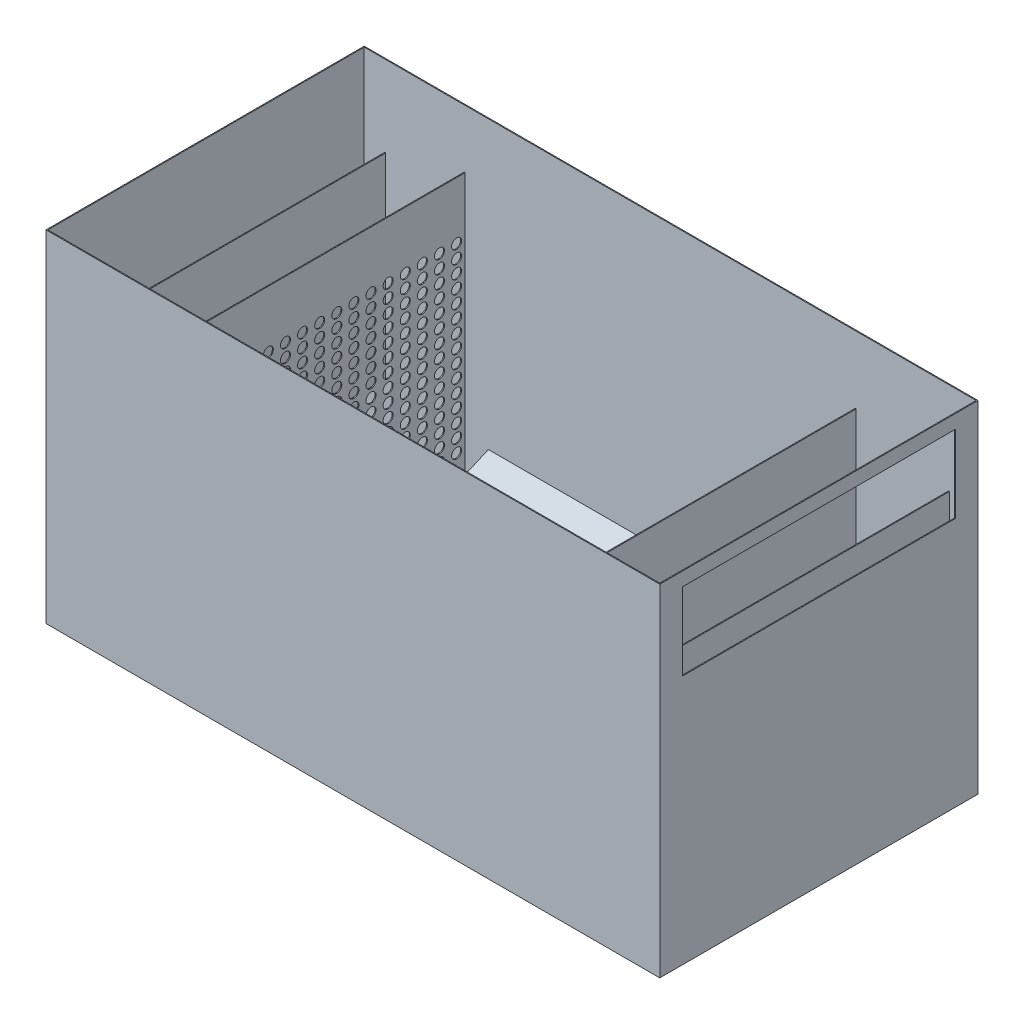
from build123d import *

# Parameters (mm, degrees)
MASTER_FOOTPRINT_W            = 1350
MASTER_FOOTPRINT_H            = 700
BATH_BASE_PLATE_DEPTH         = 750
BATH_SHELL_2MM_T              = -2
SKETCH_1_R                    = 50
INLET_D100_OPENING_DEPTH      = 10
INLET_IMPACT_BAFFLE_START     = 125
SKETCH_2_W                    = 540
SKETCH_2_H                    = 430
INLET_IMPACT_BAFFLE_DEPTH     = 2
DISTRIBUTOR_D22_START         = 250
SKETCH_3_W                    = 640
SKETCH_3_H                    = 648
SKETCH_3_R                    = 11
DISTRIBUTOR_D22_DEPTH         = 2
OUTLET_SUBMERGED_BAFFLE_START = 1130
SKETCH_4_W                    = 600
SKETCH_4_H                    = 330
OUTLET_SUBMERGED_BAFFLE_DEPTH = 2
OVERFLOW_WEIR_Z550_START      = 1290
SKETCH_5_W                    = 690
SKETCH_5_H                    = 548
OVERFLOW_WEIR_Z550_DEPTH      = 2
OUTLET_WEIR_SLOT_W600_START   = 1345
SKETCH_6_W                    = 600
SKETCH_6_H                    = 170
OUTLET_WEIR_SLOT_W600_DEPTH   = 10
SLOPED_SEDIMENT_FLOOR_START   = 275
SLOPED_SEDIMENT_FLOOR_DEPTH   = 825


with BuildPart() as part:
    # MASTER_FOOTPRINT → BATH_BASE_PLATE (new body)
    with BuildSketch(Plane(origin=(0, 0, 0), x_dir=(1, 0, 0), z_dir=(0, 1, 0))):
        with Locations((675, 350)):
            Rectangle(MASTER_FOOTPRINT_W, MASTER_FOOTPRINT_H)
    extrude(amount=BATH_BASE_PLATE_DEPTH)

    # BATH_SHELL_2MM
    bath_shell_2mm_openings = [part.faces().sort_by_distance(p)[0] for p in [
        (675, 750, -350),
    ]]
    offset(amount=BATH_SHELL_2MM_T, openings=bath_shell_2mm_openings, kind=Kind.INTERSECTION)

    # Эскиз1 → INLET_D100_OPENING (cut)
    with BuildSketch(Plane(origin=(0, 0, 0), x_dir=(0, 0, -1), z_dir=(1, 0, 0))):
        with Locations((350, 420)):
            Circle(SKETCH_1_R)
    extrude(amount=INLET_D100_OPENING_DEPTH, mode=Mode.SUBTRACT)

    # Эскиз6 → OUTLET_WEIR_SLOT_W600 (cut)
    with BuildSketch(Plane(origin=(0, 0, 0), x_dir=(0, 0, -1), z_dir=(1, 0, 0)).offset(OUTLET_WEIR_SLOT_W600_START)):
        with Locations((350, 635)):
            Rectangle(SKETCH_6_W, SKETCH_6_H)
    extrude(amount=OUTLET_WEIR_SLOT_W600_DEPTH, mode=Mode.SUBTRACT)

    # Эскиз7 → SLOPED_SEDIMENT_FLOOR (add)
    with BuildSketch(Plane(origin=(0, 0, 0), x_dir=(0, 0, -1), z_dir=(1, 0, 0)).offset(SLOPED_SEDIMENT_FLOOR_START)):
        Polygon((2, -1), (2, 120), (280, -1), align=None)
        Polygon((698, -1), (698, 120), (420, -1), align=None)
    extrude(amount=SLOPED_SEDIMENT_FLOOR_DEPTH)


with BuildPart() as body_2:
    # Эскиз2 → INLET_IMPACT_BAFFLE (new body)
    with BuildSketch(Plane(origin=(0, 0, 0), x_dir=(0, 0, -1), z_dir=(1, 0, 0)).offset(INLET_IMPACT_BAFFLE_START)):
        with Locations((350, 435)):
            Rectangle(SKETCH_2_W, SKETCH_2_H)
    extrude(amount=INLET_IMPACT_BAFFLE_DEPTH)


with BuildPart() as body_3:
    # Эскиз3 → DISTRIBUTOR_D22 (new body)
    with BuildSketch(Plane(origin=(0, 0, 0), x_dir=(0, 0, -1), z_dir=(1, 0, 0)).offset(DISTRIBUTOR_D22_START)):
        with Locations((350, 326)):
            Rectangle(SKETCH_3_W, SKETCH_3_H)
        with Locations((48.823529412, 125)):
            Circle(SKETCH_3_R, mode=Mode.SUBTRACT)
        with Locations((48.823529412, 153.5)):
            Circle(SKETCH_3_R, mode=Mode.SUBTRACT)
        with Locations((48.823529412, 182)):
            Circle(SKETCH_3_R, mode=Mode.SUBTRACT)
        with Locations((48.823529412, 210.5)):
            Circle(SKETCH_3_R, mode=Mode.SUBTRACT)
        with Locations((48.823529412, 239)):
            Circle(SKETCH_3_R, mode=Mode.SUBTRACT)
        with Locations((48.823529412, 267.5)):
            Circle(SKETCH_3_R, mode=Mode.SUBTRACT)
        with Locations((48.823529412, 296)):
            Circle(SKETCH_3_R, mode=Mode.SUBTRACT)
        with Locations((48.823529412, 324.5)):
            Circle(SKETCH_3_R, mode=Mode.SUBTRACT)
        with Locations((48.823529412, 353)):
            Circle(SKETCH_3_R, mode=Mode.SUBTRACT)
        with Locations((48.823529412, 381.5)):
            Circle(SKETCH_3_R, mode=Mode.SUBTRACT)
        with Locations((48.823529412, 410)):
            Circle(SKETCH_3_R, mode=Mode.SUBTRACT)
        with Locations((48.823529412, 438.5)):
            Circle(SKETCH_3_R, mode=Mode.SUBTRACT)
        with Locations((48.823529412, 467)):
            Circle(SKETCH_3_R, mode=Mode.SUBTRACT)
        with Locations((48.823529412, 495.5)):
            Circle(SKETCH_3_R, mode=Mode.SUBTRACT)
        with Locations((48.823529412, 524)):
            Circle(SKETCH_3_R, mode=Mode.SUBTRACT)
        with Locations((86.470588235, 125)):
            Circle(SKETCH_3_R, mode=Mode.SUBTRACT)
        with Locations((86.470588235, 153.5)):
            Circle(SKETCH_3_R, mode=Mode.SUBTRACT)
        with Locations((86.470588235, 182)):
            Circle(SKETCH_3_R, mode=Mode.SUBTRACT)
        with Locations((86.470588235, 210.5)):
            Circle(SKETCH_3_R, mode=Mode.SUBTRACT)
        with Locations((86.470588235, 239)):
            Circle(SKETCH_3_R, mode=Mode.SUBTRACT)
        with Locations((86.470588235, 267.5)):
            Circle(SKETCH_3_R, mode=Mode.SUBTRACT)
        with Locations((86.470588235, 296)):
            Circle(SKETCH_3_R, mode=Mode.SUBTRACT)
        with Locations((86.470588235, 324.5)):
            Circle(SKETCH_3_R, mode=Mode.SUBTRACT)
        with Locations((86.470588235, 353)):
            Circle(SKETCH_3_R, mode=Mode.SUBTRACT)
        with Locations((86.470588235, 381.5)):
            Circle(SKETCH_3_R, mode=Mode.SUBTRACT)
        with Locations((86.470588235, 410)):
            Circle(SKETCH_3_R, mode=Mode.SUBTRACT)
        with Locations((86.470588235, 438.5)):
            Circle(SKETCH_3_R, mode=Mode.SUBTRACT)
        with Locations((86.470588235, 467)):
            Circle(SKETCH_3_R, mode=Mode.SUBTRACT)
        with Locations((86.470588235, 495.5)):
            Circle(SKETCH_3_R, mode=Mode.SUBTRACT)
        with Locations((86.470588235, 524)):
            Circle(SKETCH_3_R, mode=Mode.SUBTRACT)
        with Locations((124.117647059, 125)):
            Circle(SKETCH_3_R, mode=Mode.SUBTRACT)
        with Locations((124.117647059, 153.5)):
            Circle(SKETCH_3_R, mode=Mode.SUBTRACT)
        with Locations((124.117647059, 182)):
            Circle(SKETCH_3_R, mode=Mode.SUBTRACT)
        with Locations((124.117647059, 210.5)):
            Circle(SKETCH_3_R, mode=Mode.SUBTRACT)
        with Locations((124.117647059, 239)):
            Circle(SKETCH_3_R, mode=Mode.SUBTRACT)
        with Locations((124.117647059, 267.5)):
            Circle(SKETCH_3_R, mode=Mode.SUBTRACT)
        with Locations((124.117647059, 296)):
            Circle(SKETCH_3_R, mode=Mode.SUBTRACT)
        with Locations((124.117647059, 324.5)):
            Circle(SKETCH_3_R, mode=Mode.SUBTRACT)
        with Locations((124.117647059, 353)):
            Circle(SKETCH_3_R, mode=Mode.SUBTRACT)
        with Locations((124.117647059, 381.5)):
            Circle(SKETCH_3_R, mode=Mode.SUBTRACT)
        with Locations((124.117647059, 410)):
            Circle(SKETCH_3_R, mode=Mode.SUBTRACT)
        with Locations((124.117647059, 438.5)):
            Circle(SKETCH_3_R, mode=Mode.SUBTRACT)
        with Locations((124.117647059, 467)):
            Circle(SKETCH_3_R, mode=Mode.SUBTRACT)
        with Locations((124.117647059, 495.5)):
            Circle(SKETCH_3_R, mode=Mode.SUBTRACT)
        with Locations((124.117647059, 524)):
            Circle(SKETCH_3_R, mode=Mode.SUBTRACT)
        with Locations((161.764705882, 125)):
            Circle(SKETCH_3_R, mode=Mode.SUBTRACT)
        with Locations((161.764705882, 153.5)):
            Circle(SKETCH_3_R, mode=Mode.SUBTRACT)
        with Locations((161.764705882, 182)):
            Circle(SKETCH_3_R, mode=Mode.SUBTRACT)
        with Locations((161.764705882, 210.5)):
            Circle(SKETCH_3_R, mode=Mode.SUBTRACT)
        with Locations((161.764705882, 239)):
            Circle(SKETCH_3_R, mode=Mode.SUBTRACT)
        with Locations((161.764705882, 267.5)):
            Circle(SKETCH_3_R, mode=Mode.SUBTRACT)
        with Locations((161.764705882, 296)):
            Circle(SKETCH_3_R, mode=Mode.SUBTRACT)
        with Locations((161.764705882, 324.5)):
            Circle(SKETCH_3_R, mode=Mode.SUBTRACT)
        with Locations((161.764705882, 353)):
            Circle(SKETCH_3_R, mode=Mode.SUBTRACT)
        with Locations((161.764705882, 381.5)):
            Circle(SKETCH_3_R, mode=Mode.SUBTRACT)
        with Locations((161.764705882, 410)):
            Circle(SKETCH_3_R, mode=Mode.SUBTRACT)
        with Locations((161.764705882, 438.5)):
            Circle(SKETCH_3_R, mode=Mode.SUBTRACT)
        with Locations((161.764705882, 467)):
            Circle(SKETCH_3_R, mode=Mode.SUBTRACT)
        with Locations((161.764705882, 495.5)):
            Circle(SKETCH_3_R, mode=Mode.SUBTRACT)
        with Locations((161.764705882, 524)):
            Circle(SKETCH_3_R, mode=Mode.SUBTRACT)
        with Locations((199.411764706, 125)):
            Circle(SKETCH_3_R, mode=Mode.SUBTRACT)
        with Locations((199.411764706, 153.5)):
            Circle(SKETCH_3_R, mode=Mode.SUBTRACT)
        with Locations((199.411764706, 182)):
            Circle(SKETCH_3_R, mode=Mode.SUBTRACT)
        with Locations((199.411764706, 210.5)):
            Circle(SKETCH_3_R, mode=Mode.SUBTRACT)
        with Locations((199.411764706, 239)):
            Circle(SKETCH_3_R, mode=Mode.SUBTRACT)
        with Locations((199.411764706, 267.5)):
            Circle(SKETCH_3_R, mode=Mode.SUBTRACT)
        with Locations((199.411764706, 296)):
            Circle(SKETCH_3_R, mode=Mode.SUBTRACT)
        with Locations((199.411764706, 324.5)):
            Circle(SKETCH_3_R, mode=Mode.SUBTRACT)
        with Locations((199.411764706, 353)):
            Circle(SKETCH_3_R, mode=Mode.SUBTRACT)
        with Locations((199.411764706, 381.5)):
            Circle(SKETCH_3_R, mode=Mode.SUBTRACT)
        with Locations((199.411764706, 410)):
            Circle(SKETCH_3_R, mode=Mode.SUBTRACT)
        with Locations((199.411764706, 438.5)):
            Circle(SKETCH_3_R, mode=Mode.SUBTRACT)
        with Locations((199.411764706, 467)):
            Circle(SKETCH_3_R, mode=Mode.SUBTRACT)
        with Locations((199.411764706, 495.5)):
            Circle(SKETCH_3_R, mode=Mode.SUBTRACT)
        with Locations((199.411764706, 524)):
            Circle(SKETCH_3_R, mode=Mode.SUBTRACT)
        with Locations((237.058823529, 125)):
            Circle(SKETCH_3_R, mode=Mode.SUBTRACT)
        with Locations((237.058823529, 153.5)):
            Circle(SKETCH_3_R, mode=Mode.SUBTRACT)
        with Locations((237.058823529, 182)):
            Circle(SKETCH_3_R, mode=Mode.SUBTRACT)
        with Locations((237.058823529, 210.5)):
            Circle(SKETCH_3_R, mode=Mode.SUBTRACT)
        with Locations((237.058823529, 239)):
            Circle(SKETCH_3_R, mode=Mode.SUBTRACT)
        with Locations((237.058823529, 267.5)):
            Circle(SKETCH_3_R, mode=Mode.SUBTRACT)
        with Locations((237.058823529, 296)):
            Circle(SKETCH_3_R, mode=Mode.SUBTRACT)
        with Locations((237.058823529, 324.5)):
            Circle(SKETCH_3_R, mode=Mode.SUBTRACT)
        with Locations((237.058823529, 353)):
            Circle(SKETCH_3_R, mode=Mode.SUBTRACT)
        with Locations((237.058823529, 381.5)):
            Circle(SKETCH_3_R, mode=Mode.SUBTRACT)
        with Locations((237.058823529, 410)):
            Circle(SKETCH_3_R, mode=Mode.SUBTRACT)
        with Locations((237.058823529, 438.5)):
            Circle(SKETCH_3_R, mode=Mode.SUBTRACT)
        with Locations((237.058823529, 467)):
            Circle(SKETCH_3_R, mode=Mode.SUBTRACT)
        with Locations((237.058823529, 495.5)):
            Circle(SKETCH_3_R, mode=Mode.SUBTRACT)
        with Locations((237.058823529, 524)):
            Circle(SKETCH_3_R, mode=Mode.SUBTRACT)
        with Locations((274.705882353, 125)):
            Circle(SKETCH_3_R, mode=Mode.SUBTRACT)
        with Locations((274.705882353, 153.5)):
            Circle(SKETCH_3_R, mode=Mode.SUBTRACT)
        with Locations((274.705882353, 182)):
            Circle(SKETCH_3_R, mode=Mode.SUBTRACT)
        with Locations((274.705882353, 210.5)):
            Circle(SKETCH_3_R, mode=Mode.SUBTRACT)
        with Locations((274.705882353, 239)):
            Circle(SKETCH_3_R, mode=Mode.SUBTRACT)
        with Locations((274.705882353, 267.5)):
            Circle(SKETCH_3_R, mode=Mode.SUBTRACT)
        with Locations((274.705882353, 296)):
            Circle(SKETCH_3_R, mode=Mode.SUBTRACT)
        with Locations((274.705882353, 324.5)):
            Circle(SKETCH_3_R, mode=Mode.SUBTRACT)
        with Locations((274.705882353, 353)):
            Circle(SKETCH_3_R, mode=Mode.SUBTRACT)
        with Locations((274.705882353, 381.5)):
            Circle(SKETCH_3_R, mode=Mode.SUBTRACT)
        with Locations((274.705882353, 410)):
            Circle(SKETCH_3_R, mode=Mode.SUBTRACT)
        with Locations((274.705882353, 438.5)):
            Circle(SKETCH_3_R, mode=Mode.SUBTRACT)
        with Locations((274.705882353, 467)):
            Circle(SKETCH_3_R, mode=Mode.SUBTRACT)
        with Locations((274.705882353, 495.5)):
            Circle(SKETCH_3_R, mode=Mode.SUBTRACT)
        with Locations((274.705882353, 524)):
            Circle(SKETCH_3_R, mode=Mode.SUBTRACT)
        with Locations((312.352941176, 125)):
            Circle(SKETCH_3_R, mode=Mode.SUBTRACT)
        with Locations((312.352941176, 153.5)):
            Circle(SKETCH_3_R, mode=Mode.SUBTRACT)
        with Locations((312.352941176, 182)):
            Circle(SKETCH_3_R, mode=Mode.SUBTRACT)
        with Locations((312.352941176, 210.5)):
            Circle(SKETCH_3_R, mode=Mode.SUBTRACT)
        with Locations((312.352941176, 239)):
            Circle(SKETCH_3_R, mode=Mode.SUBTRACT)
        with Locations((312.352941176, 267.5)):
            Circle(SKETCH_3_R, mode=Mode.SUBTRACT)
        with Locations((312.352941176, 296)):
            Circle(SKETCH_3_R, mode=Mode.SUBTRACT)
        with Locations((312.352941176, 324.5)):
            Circle(SKETCH_3_R, mode=Mode.SUBTRACT)
        with Locations((312.352941176, 353)):
            Circle(SKETCH_3_R, mode=Mode.SUBTRACT)
        with Locations((312.352941176, 381.5)):
            Circle(SKETCH_3_R, mode=Mode.SUBTRACT)
        with Locations((312.352941176, 410)):
            Circle(SKETCH_3_R, mode=Mode.SUBTRACT)
        with Locations((312.352941176, 438.5)):
            Circle(SKETCH_3_R, mode=Mode.SUBTRACT)
        with Locations((312.352941176, 467)):
            Circle(SKETCH_3_R, mode=Mode.SUBTRACT)
        with Locations((312.352941176, 495.5)):
            Circle(SKETCH_3_R, mode=Mode.SUBTRACT)
        with Locations((312.352941176, 524)):
            Circle(SKETCH_3_R, mode=Mode.SUBTRACT)
        with Locations((350, 125)):
            Circle(SKETCH_3_R, mode=Mode.SUBTRACT)
        with Locations((350, 153.5)):
            Circle(SKETCH_3_R, mode=Mode.SUBTRACT)
        with Locations((350, 182)):
            Circle(SKETCH_3_R, mode=Mode.SUBTRACT)
        with Locations((350, 210.5)):
            Circle(SKETCH_3_R, mode=Mode.SUBTRACT)
        with Locations((350, 239)):
            Circle(SKETCH_3_R, mode=Mode.SUBTRACT)
        with Locations((350, 267.5)):
            Circle(SKETCH_3_R, mode=Mode.SUBTRACT)
        with Locations((350, 296)):
            Circle(SKETCH_3_R, mode=Mode.SUBTRACT)
        with Locations((350, 324.5)):
            Circle(SKETCH_3_R, mode=Mode.SUBTRACT)
        with Locations((350, 353)):
            Circle(SKETCH_3_R, mode=Mode.SUBTRACT)
        with Locations((350, 381.5)):
            Circle(SKETCH_3_R, mode=Mode.SUBTRACT)
        with Locations((350, 410)):
            Circle(SKETCH_3_R, mode=Mode.SUBTRACT)
        with Locations((350, 438.5)):
            Circle(SKETCH_3_R, mode=Mode.SUBTRACT)
        with Locations((350, 467)):
            Circle(SKETCH_3_R, mode=Mode.SUBTRACT)
        with Locations((350, 495.5)):
            Circle(SKETCH_3_R, mode=Mode.SUBTRACT)
        with Locations((350, 524)):
            Circle(SKETCH_3_R, mode=Mode.SUBTRACT)
        with Locations((387.647058824, 125)):
            Circle(SKETCH_3_R, mode=Mode.SUBTRACT)
        with Locations((387.647058824, 153.5)):
            Circle(SKETCH_3_R, mode=Mode.SUBTRACT)
        with Locations((387.647058824, 182)):
            Circle(SKETCH_3_R, mode=Mode.SUBTRACT)
        with Locations((387.647058824, 210.5)):
            Circle(SKETCH_3_R, mode=Mode.SUBTRACT)
        with Locations((387.647058824, 239)):
            Circle(SKETCH_3_R, mode=Mode.SUBTRACT)
        with Locations((387.647058824, 267.5)):
            Circle(SKETCH_3_R, mode=Mode.SUBTRACT)
        with Locations((387.647058824, 296)):
            Circle(SKETCH_3_R, mode=Mode.SUBTRACT)
        with Locations((387.647058824, 324.5)):
            Circle(SKETCH_3_R, mode=Mode.SUBTRACT)
        with Locations((387.647058824, 353)):
            Circle(SKETCH_3_R, mode=Mode.SUBTRACT)
        with Locations((387.647058824, 381.5)):
            Circle(SKETCH_3_R, mode=Mode.SUBTRACT)
        with Locations((387.647058824, 410)):
            Circle(SKETCH_3_R, mode=Mode.SUBTRACT)
        with Locations((387.647058824, 438.5)):
            Circle(SKETCH_3_R, mode=Mode.SUBTRACT)
        with Locations((387.647058824, 467)):
            Circle(SKETCH_3_R, mode=Mode.SUBTRACT)
        with Locations((387.647058824, 495.5)):
            Circle(SKETCH_3_R, mode=Mode.SUBTRACT)
        with Locations((387.647058824, 524)):
            Circle(SKETCH_3_R, mode=Mode.SUBTRACT)
        with Locations((425.294117647, 125)):
            Circle(SKETCH_3_R, mode=Mode.SUBTRACT)
        with Locations((425.294117647, 153.5)):
            Circle(SKETCH_3_R, mode=Mode.SUBTRACT)
        with Locations((425.294117647, 182)):
            Circle(SKETCH_3_R, mode=Mode.SUBTRACT)
        with Locations((425.294117647, 210.5)):
            Circle(SKETCH_3_R, mode=Mode.SUBTRACT)
        with Locations((425.294117647, 239)):
            Circle(SKETCH_3_R, mode=Mode.SUBTRACT)
        with Locations((425.294117647, 267.5)):
            Circle(SKETCH_3_R, mode=Mode.SUBTRACT)
        with Locations((425.294117647, 296)):
            Circle(SKETCH_3_R, mode=Mode.SUBTRACT)
        with Locations((425.294117647, 324.5)):
            Circle(SKETCH_3_R, mode=Mode.SUBTRACT)
        with Locations((425.294117647, 353)):
            Circle(SKETCH_3_R, mode=Mode.SUBTRACT)
        with Locations((425.294117647, 381.5)):
            Circle(SKETCH_3_R, mode=Mode.SUBTRACT)
        with Locations((425.294117647, 410)):
            Circle(SKETCH_3_R, mode=Mode.SUBTRACT)
        with Locations((425.294117647, 438.5)):
            Circle(SKETCH_3_R, mode=Mode.SUBTRACT)
        with Locations((425.294117647, 467)):
            Circle(SKETCH_3_R, mode=Mode.SUBTRACT)
        with Locations((425.294117647, 495.5)):
            Circle(SKETCH_3_R, mode=Mode.SUBTRACT)
        with Locations((425.294117647, 524)):
            Circle(SKETCH_3_R, mode=Mode.SUBTRACT)
        with Locations((462.941176471, 125)):
            Circle(SKETCH_3_R, mode=Mode.SUBTRACT)
        with Locations((462.941176471, 153.5)):
            Circle(SKETCH_3_R, mode=Mode.SUBTRACT)
        with Locations((462.941176471, 182)):
            Circle(SKETCH_3_R, mode=Mode.SUBTRACT)
        with Locations((462.941176471, 210.5)):
            Circle(SKETCH_3_R, mode=Mode.SUBTRACT)
        with Locations((462.941176471, 239)):
            Circle(SKETCH_3_R, mode=Mode.SUBTRACT)
        with Locations((462.941176471, 267.5)):
            Circle(SKETCH_3_R, mode=Mode.SUBTRACT)
        with Locations((462.941176471, 296)):
            Circle(SKETCH_3_R, mode=Mode.SUBTRACT)
        with Locations((462.941176471, 324.5)):
            Circle(SKETCH_3_R, mode=Mode.SUBTRACT)
        with Locations((462.941176471, 353)):
            Circle(SKETCH_3_R, mode=Mode.SUBTRACT)
        with Locations((462.941176471, 381.5)):
            Circle(SKETCH_3_R, mode=Mode.SUBTRACT)
        with Locations((462.941176471, 410)):
            Circle(SKETCH_3_R, mode=Mode.SUBTRACT)
        with Locations((462.941176471, 438.5)):
            Circle(SKETCH_3_R, mode=Mode.SUBTRACT)
        with Locations((462.941176471, 467)):
            Circle(SKETCH_3_R, mode=Mode.SUBTRACT)
        with Locations((462.941176471, 495.5)):
            Circle(SKETCH_3_R, mode=Mode.SUBTRACT)
        with Locations((462.941176471, 524)):
            Circle(SKETCH_3_R, mode=Mode.SUBTRACT)
        with Locations((500.588235294, 125)):
            Circle(SKETCH_3_R, mode=Mode.SUBTRACT)
        with Locations((500.588235294, 153.5)):
            Circle(SKETCH_3_R, mode=Mode.SUBTRACT)
        with Locations((500.588235294, 182)):
            Circle(SKETCH_3_R, mode=Mode.SUBTRACT)
        with Locations((500.588235294, 210.5)):
            Circle(SKETCH_3_R, mode=Mode.SUBTRACT)
        with Locations((500.588235294, 239)):
            Circle(SKETCH_3_R, mode=Mode.SUBTRACT)
        with Locations((500.588235294, 267.5)):
            Circle(SKETCH_3_R, mode=Mode.SUBTRACT)
        with Locations((500.588235294, 296)):
            Circle(SKETCH_3_R, mode=Mode.SUBTRACT)
        with Locations((500.588235294, 324.5)):
            Circle(SKETCH_3_R, mode=Mode.SUBTRACT)
        with Locations((500.588235294, 353)):
            Circle(SKETCH_3_R, mode=Mode.SUBTRACT)
        with Locations((500.588235294, 381.5)):
            Circle(SKETCH_3_R, mode=Mode.SUBTRACT)
        with Locations((500.588235294, 410)):
            Circle(SKETCH_3_R, mode=Mode.SUBTRACT)
        with Locations((500.588235294, 438.5)):
            Circle(SKETCH_3_R, mode=Mode.SUBTRACT)
        with Locations((500.588235294, 467)):
            Circle(SKETCH_3_R, mode=Mode.SUBTRACT)
        with Locations((500.588235294, 495.5)):
            Circle(SKETCH_3_R, mode=Mode.SUBTRACT)
        with Locations((500.588235294, 524)):
            Circle(SKETCH_3_R, mode=Mode.SUBTRACT)
        with Locations((538.235294118, 125)):
            Circle(SKETCH_3_R, mode=Mode.SUBTRACT)
        with Locations((538.235294118, 153.5)):
            Circle(SKETCH_3_R, mode=Mode.SUBTRACT)
        with Locations((538.235294118, 182)):
            Circle(SKETCH_3_R, mode=Mode.SUBTRACT)
        with Locations((538.235294118, 210.5)):
            Circle(SKETCH_3_R, mode=Mode.SUBTRACT)
        with Locations((538.235294118, 239)):
            Circle(SKETCH_3_R, mode=Mode.SUBTRACT)
        with Locations((538.235294118, 267.5)):
            Circle(SKETCH_3_R, mode=Mode.SUBTRACT)
        with Locations((538.235294118, 296)):
            Circle(SKETCH_3_R, mode=Mode.SUBTRACT)
        with Locations((538.235294118, 324.5)):
            Circle(SKETCH_3_R, mode=Mode.SUBTRACT)
        with Locations((538.235294118, 353)):
            Circle(SKETCH_3_R, mode=Mode.SUBTRACT)
        with Locations((538.235294118, 381.5)):
            Circle(SKETCH_3_R, mode=Mode.SUBTRACT)
        with Locations((538.235294118, 410)):
            Circle(SKETCH_3_R, mode=Mode.SUBTRACT)
        with Locations((538.235294118, 438.5)):
            Circle(SKETCH_3_R, mode=Mode.SUBTRACT)
        with Locations((538.235294118, 467)):
            Circle(SKETCH_3_R, mode=Mode.SUBTRACT)
        with Locations((538.235294118, 495.5)):
            Circle(SKETCH_3_R, mode=Mode.SUBTRACT)
        with Locations((538.235294118, 524)):
            Circle(SKETCH_3_R, mode=Mode.SUBTRACT)
        with Locations((575.882352941, 125)):
            Circle(SKETCH_3_R, mode=Mode.SUBTRACT)
        with Locations((575.882352941, 153.5)):
            Circle(SKETCH_3_R, mode=Mode.SUBTRACT)
        with Locations((575.882352941, 182)):
            Circle(SKETCH_3_R, mode=Mode.SUBTRACT)
        with Locations((575.882352941, 210.5)):
            Circle(SKETCH_3_R, mode=Mode.SUBTRACT)
        with Locations((575.882352941, 239)):
            Circle(SKETCH_3_R, mode=Mode.SUBTRACT)
        with Locations((575.882352941, 267.5)):
            Circle(SKETCH_3_R, mode=Mode.SUBTRACT)
        with Locations((575.882352941, 296)):
            Circle(SKETCH_3_R, mode=Mode.SUBTRACT)
        with Locations((575.882352941, 324.5)):
            Circle(SKETCH_3_R, mode=Mode.SUBTRACT)
        with Locations((575.882352941, 353)):
            Circle(SKETCH_3_R, mode=Mode.SUBTRACT)
        with Locations((575.882352941, 381.5)):
            Circle(SKETCH_3_R, mode=Mode.SUBTRACT)
        with Locations((575.882352941, 410)):
            Circle(SKETCH_3_R, mode=Mode.SUBTRACT)
        with Locations((575.882352941, 438.5)):
            Circle(SKETCH_3_R, mode=Mode.SUBTRACT)
        with Locations((575.882352941, 467)):
            Circle(SKETCH_3_R, mode=Mode.SUBTRACT)
        with Locations((575.882352941, 495.5)):
            Circle(SKETCH_3_R, mode=Mode.SUBTRACT)
        with Locations((575.882352941, 524)):
            Circle(SKETCH_3_R, mode=Mode.SUBTRACT)
        with Locations((613.529411765, 125)):
            Circle(SKETCH_3_R, mode=Mode.SUBTRACT)
        with Locations((613.529411765, 153.5)):
            Circle(SKETCH_3_R, mode=Mode.SUBTRACT)
        with Locations((613.529411765, 182)):
            Circle(SKETCH_3_R, mode=Mode.SUBTRACT)
        with Locations((613.529411765, 210.5)):
            Circle(SKETCH_3_R, mode=Mode.SUBTRACT)
        with Locations((613.529411765, 239)):
            Circle(SKETCH_3_R, mode=Mode.SUBTRACT)
        with Locations((613.529411765, 267.5)):
            Circle(SKETCH_3_R, mode=Mode.SUBTRACT)
        with Locations((613.529411765, 296)):
            Circle(SKETCH_3_R, mode=Mode.SUBTRACT)
        with Locations((613.529411765, 324.5)):
            Circle(SKETCH_3_R, mode=Mode.SUBTRACT)
        with Locations((613.529411765, 353)):
            Circle(SKETCH_3_R, mode=Mode.SUBTRACT)
        with Locations((613.529411765, 381.5)):
            Circle(SKETCH_3_R, mode=Mode.SUBTRACT)
        with Locations((613.529411765, 410)):
            Circle(SKETCH_3_R, mode=Mode.SUBTRACT)
        with Locations((613.529411765, 438.5)):
            Circle(SKETCH_3_R, mode=Mode.SUBTRACT)
        with Locations((613.529411765, 467)):
            Circle(SKETCH_3_R, mode=Mode.SUBTRACT)
        with Locations((613.529411765, 495.5)):
            Circle(SKETCH_3_R, mode=Mode.SUBTRACT)
        with Locations((613.529411765, 524)):
            Circle(SKETCH_3_R, mode=Mode.SUBTRACT)
        with Locations((651.176470588, 125)):
            Circle(SKETCH_3_R, mode=Mode.SUBTRACT)
        with Locations((651.176470588, 153.5)):
            Circle(SKETCH_3_R, mode=Mode.SUBTRACT)
        with Locations((651.176470588, 182)):
            Circle(SKETCH_3_R, mode=Mode.SUBTRACT)
        with Locations((651.176470588, 210.5)):
            Circle(SKETCH_3_R, mode=Mode.SUBTRACT)
        with Locations((651.176470588, 239)):
            Circle(SKETCH_3_R, mode=Mode.SUBTRACT)
        with Locations((651.176470588, 267.5)):
            Circle(SKETCH_3_R, mode=Mode.SUBTRACT)
        with Locations((651.176470588, 296)):
            Circle(SKETCH_3_R, mode=Mode.SUBTRACT)
        with Locations((651.176470588, 324.5)):
            Circle(SKETCH_3_R, mode=Mode.SUBTRACT)
        with Locations((651.176470588, 353)):
            Circle(SKETCH_3_R, mode=Mode.SUBTRACT)
        with Locations((651.176470588, 381.5)):
            Circle(SKETCH_3_R, mode=Mode.SUBTRACT)
        with Locations((651.176470588, 410)):
            Circle(SKETCH_3_R, mode=Mode.SUBTRACT)
        with Locations((651.176470588, 438.5)):
            Circle(SKETCH_3_R, mode=Mode.SUBTRACT)
        with Locations((651.176470588, 467)):
            Circle(SKETCH_3_R, mode=Mode.SUBTRACT)
        with Locations((651.176470588, 495.5)):
            Circle(SKETCH_3_R, mode=Mode.SUBTRACT)
        with Locations((651.176470588, 524)):
            Circle(SKETCH_3_R, mode=Mode.SUBTRACT)
    extrude(amount=DISTRIBUTOR_D22_DEPTH)


with BuildPart() as body_4:
    # Эскиз4 → OUTLET_SUBMERGED_BAFFLE (new body)
    with BuildSketch(Plane(origin=(0, 0, 0), x_dir=(0, 0, -1), z_dir=(1, 0, 0)).offset(OUTLET_SUBMERGED_BAFFLE_START)):
        with Locations((350, 485)):
            Rectangle(SKETCH_4_W, SKETCH_4_H)
    extrude(amount=OUTLET_SUBMERGED_BAFFLE_DEPTH)


with BuildPart() as body_5:
    # Эскиз5 → OVERFLOW_WEIR_Z550 (new body)
    with BuildSketch(Plane(origin=(0, 0, 0), x_dir=(0, 0, -1), z_dir=(1, 0, 0)).offset(OVERFLOW_WEIR_Z550_START)):
        with Locations((350, 276)):
            Rectangle(SKETCH_5_W, SKETCH_5_H)
    extrude(amount=OVERFLOW_WEIR_Z550_DEPTH)


solid = Compound([part.part, body_2.part, body_3.part, body_4.part, body_5.part])
